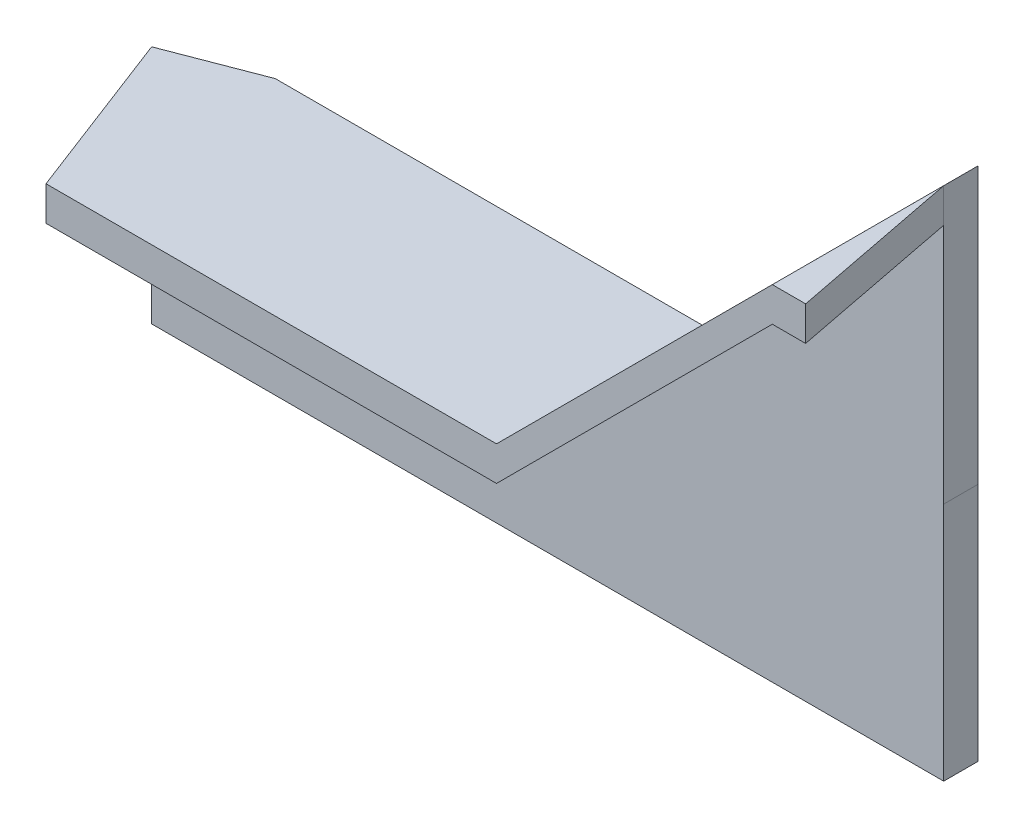
from build123d import *

# Parameters (mm, degrees)
SKETCH1_W               = 69
SKETCH1_H               = 14
BOSS_EXTRUDE1_DEPTH     = 2
SKETCH2_W               = 52.910547302
SKETCH2_H               = 2
BOSS_EXTRUDE2_DEPTH     = 4
CUT_EXTRUDE1_DEPTH      = 20
CUT_EXTRUDE1_DEPTH_BACK = 20
CUT_EXTRUDE2_DEPTH      = 2
BOSS_EXTRUDE3_DEPTH     = 2
BOSS_EXTRUDE4_DEPTH     = 4
BOSS_EXTRUDE5_DEPTH     = 6
CUT_EXTRUDE3_DEPTH      = 6
BOSS_EXTRUDE6_START     = -16.09
BOSS_EXTRUDE6_DEPTH     = 2


with BuildPart() as part:
    # Sketch1 → Boss-Extrude1 (new body)
    with BuildSketch(Plane.XY):
        with Locations((-11.678861789, -0.654471545)):
            Rectangle(SKETCH1_W, SKETCH1_H)
    extrude(amount=BOSS_EXTRUDE1_DEPTH)

    # Sketch2 → Boss-Extrude2 (add)
    with BuildSketch(Plane.XY.offset(2)):
        with Locations((-19.723588138, 5.345528455)):
            Rectangle(SKETCH2_W, SKETCH2_H)
    extrude(amount=BOSS_EXTRUDE2_DEPTH)

    # Sketch4 → Cut-Extrude1 (cut, two sides: drawn at the far end of the back side and taken through both)
    with BuildSketch(Plane(origin=(0, 6.345528455, 0), x_dir=(1, 0, 0), z_dir=(0, 1, 0)).offset(-CUT_EXTRUDE1_DEPTH_BACK)):
        Polygon((-18.178861789, 0), (-33.809396177, -6), (-46.178861789, -6), (-46.178861789, 0), align=None)
    extrude(amount=CUT_EXTRUDE1_DEPTH + CUT_EXTRUDE1_DEPTH_BACK, mode=Mode.SUBTRACT)

    # Sketch5 → Cut-Extrude2 (cut)
    with BuildSketch(Plane(origin=(0, 6.345528455, 0), x_dir=(1, 0, 0), z_dir=(0, 1, 0))):
        Polygon((-33.809396177, -6), (-23.38959077, -2.000211452), (-21.854215798, -6), align=None)
    extrude(amount=-CUT_EXTRUDE2_DEPTH, mode=Mode.SUBTRACT)

    # Sketch6 → Boss-Extrude3 (add)
    with BuildSketch(Plane.XY.offset(2)):
        Polygon((6.731685513, 6.345528455), (22.821685513, 22.435528455), (22.821138211, 6.345528455), align=None)
    extrude(amount=-BOSS_EXTRUDE3_DEPTH)

    # Sketch7 → Boss-Extrude4 (add)
    with BuildSketch(Plane.XY.offset(2)):
        Polygon((6.731685513, 4.345528455), (22.821617483, 20.435528456), (22.821685513, 22.435528455), (6.731685513, 6.345528455), align=None)
    extrude(amount=BOSS_EXTRUDE4_DEPTH)

    # Sketch8 → Boss-Extrude5 (add)
    with BuildSketch(Plane.XY.offset(6)):
        Polygon((22.821685513, 22.435528455), (6.731685513, 6.345528455), (-21.854215798, 6.345528455), (-21.854215798, 4.345528455), (6.731685513, 4.345528455), (22.821617483, 20.435528456), align=None)
    extrude(amount=BOSS_EXTRUDE5_DEPTH)

    # Sketch9 → Cut-Extrude3 (cut)
    with BuildSketch(Plane.XZ.offset(-4.345528455)):
        Polygon((-23.389039918, 2), (-21.854215798, 6), (-19.551979619, 12), (-21.854215798, 12), align=None)
    extrude(amount=-CUT_EXTRUDE3_DEPTH, mode=Mode.SUBTRACT)


with BuildPart() as cut_extrude3_piece_1:
    # of the separate pieces the step leaves, piece 1, a body of its own (cut_extrude3_pieces)
    add(part.part.solids().sort_by_distance((-18.178861789, 6.345528455, 0))[0])

    # Sketch10 → Boss-Extrude6 (add)
    with BuildSketch(Plane.XZ.offset(-4.345528455).offset(BOSS_EXTRUDE6_START)):
        Polygon((22.821617483, 12), (24.765438688, 12), (22.821138211, 2), align=None)
    extrude(amount=-BOSS_EXTRUDE6_DEPTH)


with BuildPart() as cut_extrude3_piece_2:
    # of the separate pieces the step leaves, piece 2, a body of its own (cut_extrude3_pieces)
    add(part.part.solids().sort_by_distance((-23.38861886, 6.345528455, 2.002743364))[0])


solid = Compound([cut_extrude3_piece_1.part, cut_extrude3_piece_2.part])
